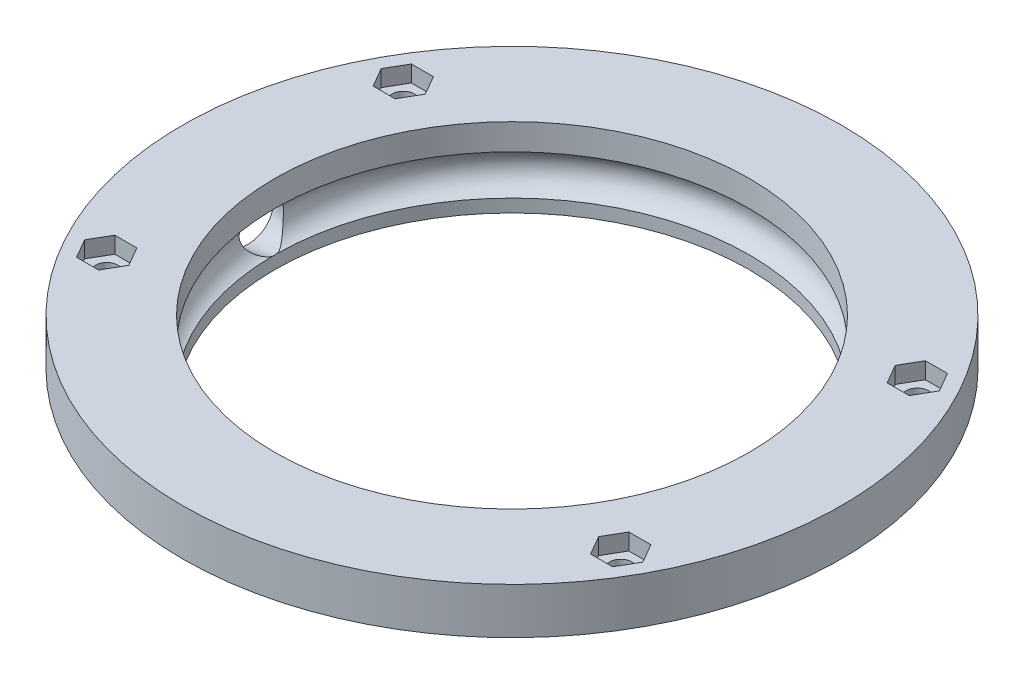
from build123d import *

# Parameters (mm, degrees)
CROQUIS4_R            = 1.7
CORTAR_EXTRUIR1_DEPTH = 10
CORTAR_EXTRUIR2_DEPTH = 2.5


with BuildPart() as part:
    # Croquis1 → Revolución1 (revolve)
    with BuildSketch(Plane.XY, mode=Mode.PRIVATE) as revoluci_n1_sk:
        with BuildLine():
            Line((50, 12), (36, 12))
            Line((36, 12), (36, 8.039736831))
            ThreePointArc((36, 8.039736831), (38.2, 5), (36, 1.960263169))
            Line((36, 1.960263169), (36, 0))
            Line((36, 0), (40, 0))
            Line((40, 0), (40, 5))
            Line((40, 5), (50, 5))
            Line((50, 5), (50, 12))
        make_face()
    revolve(revoluci_n1_sk.sketch.rotate(Axis((0, 9.671658493, 0), (0, -1, 0)), 90), axis=Axis((0, 9.671658493, 0), (0, -1, 0)))

    # Croquis2 → Cortar-Revolución1 (revolve, cut)
    with BuildSketch(Plane(origin=(0, 5, 0), x_dir=(1, 0, 0), z_dir=(0, 1, 0)), mode=Mode.PRIVATE) as cortar_revoluci_n1_sk:
        Polygon((-35.5, 0), (-51.5, 0), (-51.5, 3.7), (-40.5, 3.7), (-35.5, 3), align=None)
    revolve(cortar_revoluci_n1_sk.sketch.rotate(Axis((-54.955446394, 5, 0), (1, 0, 0)), 180), axis=Axis((-54.955446394, 5, 0), (1, 0, 0)), mode=Mode.SUBTRACT)

    # Croquis4 → Cortar-Extruir1 (cut)
    with BuildSketch(Plane(origin=(0, 12, 0), x_dir=(1, 0, 0), z_dir=(0, 1, 0))):
        with Locations(Location((-39, 22.5, 0), (0, 0, 270))):
            Circle(CROQUIS4_R)
        with Locations(Location((39, 22.5, 0), (0, 0, 270))):
            Circle(CROQUIS4_R)
        with Locations(Location((39, -22.5, 0), (0, 0, 270))):
            Circle(CROQUIS4_R)
        with Locations(Location((-39, -22.5, 0), (0, 0, 270))):
            Circle(CROQUIS4_R)
    extrude(amount=-CORTAR_EXTRUIR1_DEPTH, mode=Mode.SUBTRACT)

    # Croquis5 → Cortar-Extruir2 (cut)
    with BuildSketch(Plane(origin=(0, 12, 0), x_dir=(1, 0, 0), z_dir=(0, 1, 0))):
        Polygon((-42.35, 22.5), (-40.675, 19.598814897), (-37.325, 19.598814897), (-35.65, 22.5), (-37.325, 25.401185103), (-40.675, 25.401185103), align=None)
        Polygon((-42.35, -22.5), (-40.675, -25.401185103), (-37.325, -25.401185103), (-35.65, -22.5), (-37.325, -19.598814897), (-40.675, -19.598814897), align=None)
        Polygon((35.65, 22.5), (37.325, 19.598814897), (40.675, 19.598814897), (42.35, 22.5), (40.675, 25.401185103), (37.325, 25.401185103), align=None)
        Polygon((35.65, -22.5), (37.325, -25.401185103), (40.675, -25.401185103), (42.35, -22.5), (40.675, -19.598814897), (37.325, -19.598814897), align=None)
    extrude(amount=-CORTAR_EXTRUIR2_DEPTH, mode=Mode.SUBTRACT)


solid = part.part
